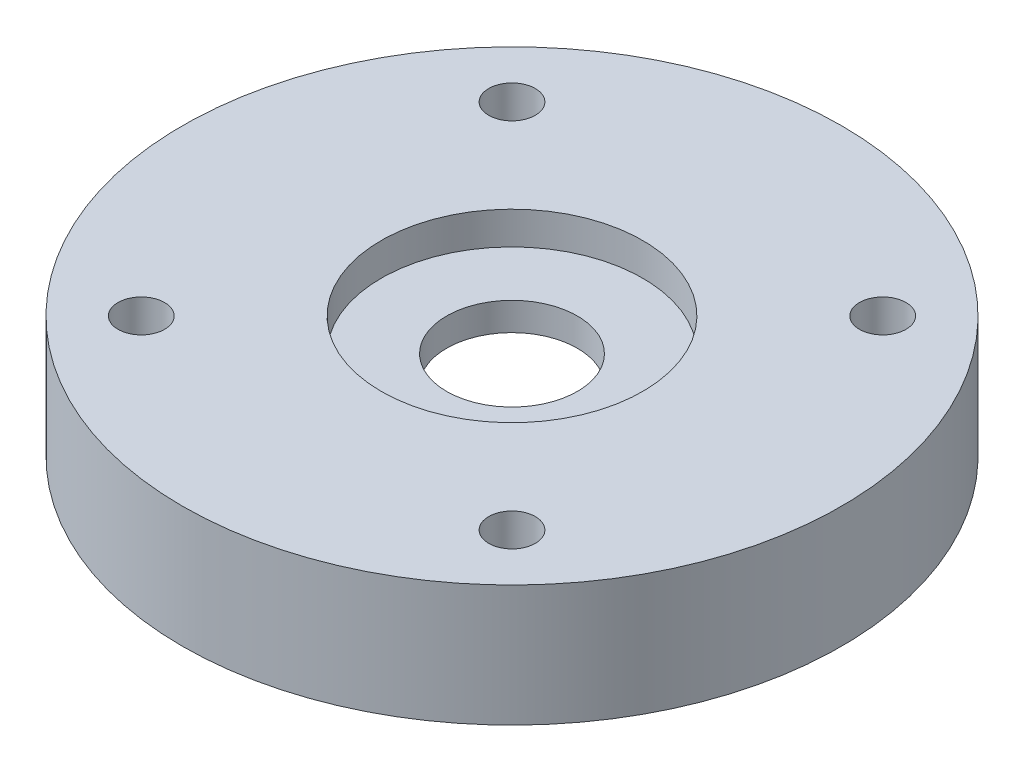
from build123d import *

# Parameters (mm, degrees)
SKETCH2_R             = 16.002
BOSS_EXTRUDE2_DEPTH   = 5.8928
CUT_EXTRUDE1_DEPTH    = 2.9464
F_4_40_TAPPED_HOLE1_D = 2.2606
SKETCH3_R             = 3.175
CUT_EXTRUDE2_DEPTH    = 24.384890418
SKETCH5_R             = 6.35
CUT_EXTRUDE3_DEPTH    = 1.5875


with BuildPart() as part:
    # Sketch2 → Boss-Extrude2 (new body)
    with BuildSketch(Plane(origin=(0, 0, 0), x_dir=(1, 0, 0), z_dir=(0, 1, 0))):
        Circle(SKETCH2_R)
    extrude(amount=BOSS_EXTRUDE2_DEPTH)

    # Sketch2<3> → Cut-Extrude1 (cut)
    with BuildSketch(Plane(origin=(0, 0, 0), x_dir=(1, 0, 0), z_dir=(0, 1, 0))):
        with BuildLine():
            ThreePointArc((9.017, 4.192712226), (0, 9.9441), (-9.017, 4.192712226))
            Line((-9.017, 4.192712226), (-9.017, -4.192712226))
            ThreePointArc((-9.017, -4.192712226), (0, -9.9441), (9.017, -4.192712226))
            Line((9.017, -4.192712226), (9.017, 4.192712226))
        make_face()
    extrude(amount=CUT_EXTRUDE1_DEPTH, mode=Mode.SUBTRACT)

    # #4-40 Tapped Hole1 (through all)
    with Locations(Plane(origin=(-8.999982, 0, 8.999982), x_dir=(0, 0, -1), z_dir=(0, -1, 0))):
        with Locations((0, 0), (0, 17.999964), (17.999964, 17.999964), (17.999964, 0)):
            Hole(F_4_40_TAPPED_HOLE1_D / 2)

    # Sketch3 → Cut-Extrude2 (cut, through all)
    with BuildSketch(Plane.XZ):
        Circle(SKETCH3_R)
    extrude(amount=-CUT_EXTRUDE2_DEPTH, mode=Mode.SUBTRACT)

    # Sketch5 → Cut-Extrude3 (cut)
    with BuildSketch(Plane(origin=(0, 5.8928, 0), x_dir=(1, 0, 0), z_dir=(0, 1, 0))):
        Circle(SKETCH5_R)
    extrude(amount=-CUT_EXTRUDE3_DEPTH, mode=Mode.SUBTRACT)


solid = part.part
